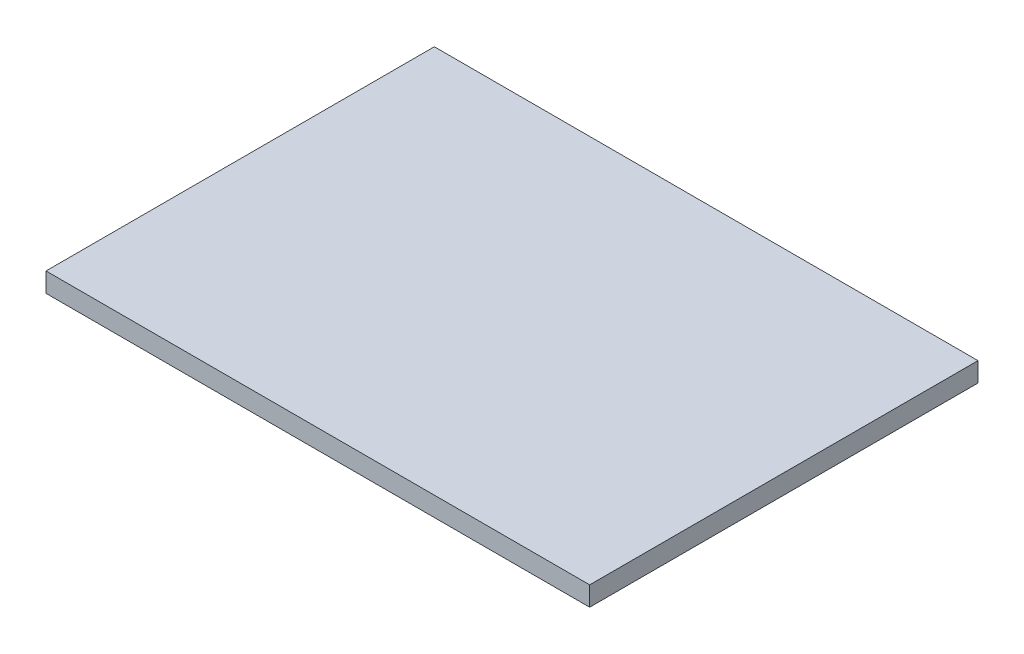
from build123d import *

# Parameters (mm, degrees)
SKBASEFIJAPLATAFORMA_W   = 700
SKBASEFIJAPLATAFORMA_H   = 500
BASEFIJAPLATAFORMA_DEPTH = 25


with BuildPart() as part:
    # SkBaseFijaPlataforma → BaseFijaPlataforma (new body)
    with BuildSketch(Plane(origin=(0, 0, 0), x_dir=(1, 0, 0), z_dir=(0, 1, 0))):
        Rectangle(SKBASEFIJAPLATAFORMA_W, SKBASEFIJAPLATAFORMA_H)
    extrude(amount=BASEFIJAPLATAFORMA_DEPTH)


solid = part.part
